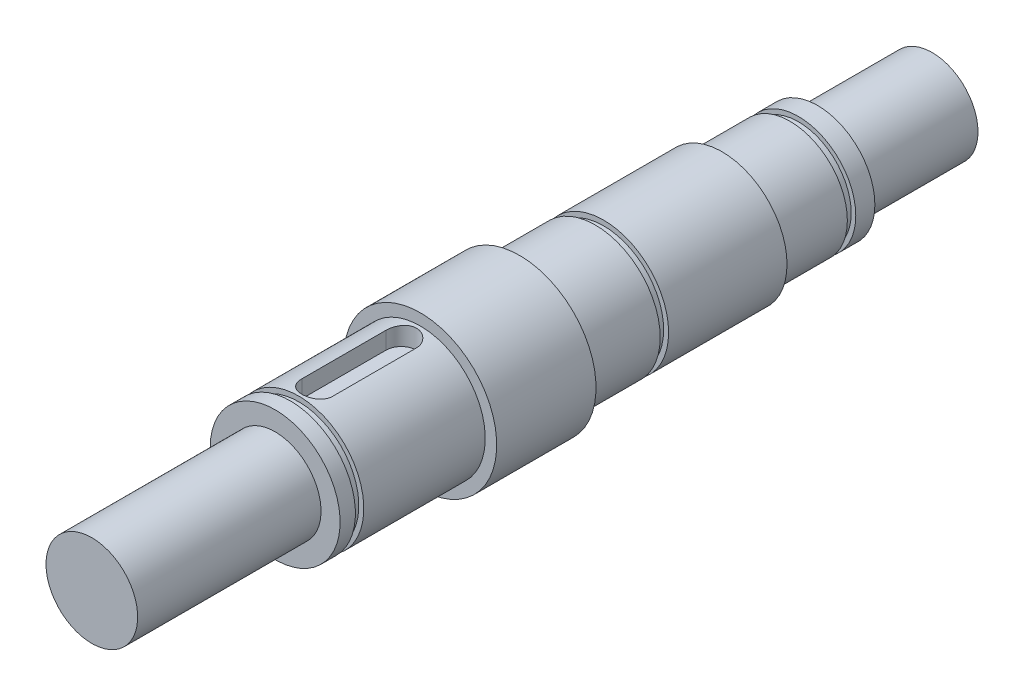
from build123d import *

# Parameters (mm, degrees)
SKETCH1_R               = 10
BOSS_EXTRUDE1_DEPTH     = 61
SKETCH3_W               = 66
SKETCH3_H               = 1.5
SKETCH4_W               = 43
SKETCH4_H               = 1.5
SKETCH5_W               = 24
SKETCH5_H               = 2.5
SKETCH6_W               = 39.5
SKETCH6_H               = 1
SKETCH7_W               = 27
SKETCH7_H               = 1.5
SKETCH8_W               = 1.1
SKETCH8_H               = 0.6
SKETCH9_W               = 1.1
SKETCH9_H               = 0.65
SKETCH10_W              = 1.1
SKETCH10_H              = 0.65
CUT_EXTRUDE1_DEPTH      = 63.617888818
CUT_EXTRUDE1_DEPTH_BACK = 63.617888818
SKETCH11_W              = 12
SKETCH11_H              = 12
CUT_EXTRUDE2_DEPTH      = 2.5


with BuildPart() as part:
    # Sketch1 → Boss-Extrude1 (new, symmetric)
    with BuildSketch(Plane.XY):
        with Locations(Location((0, 0, 0), (0, 0, 180))):
            Circle(SKETCH1_R)
    extrude(amount=BOSS_EXTRUDE1_DEPTH, both=True)

    # Sketch3 → Cut-Revolve1 (revolve, cut)
    with BuildSketch(Plane(origin=(0, 0, 0), x_dir=(0, 0, -1), z_dir=(1, 0, 0)), mode=Mode.PRIVATE) as cut_revolve1_sk:
        with Locations((28, 9.25)):
            Rectangle(SKETCH3_W, SKETCH3_H)
    revolve(cut_revolve1_sk.sketch.rotate(Axis((0, 0, 0), (0, 0, -1)), 270), axis=Axis((0, 0, 0), (0, 0, -1)), mode=Mode.SUBTRACT)

    # Sketch4 → Cut-Revolve2 (revolve, cut)
    with BuildSketch(Plane(origin=(0, 0, 0), x_dir=(0, 0, -1), z_dir=(1, 0, 0)), mode=Mode.PRIVATE) as cut_revolve2_sk:
        with Locations((-39.5, 9.25)):
            Rectangle(SKETCH4_W, SKETCH4_H)
    revolve(cut_revolve2_sk.sketch.rotate(Axis((0, 0, 0), (0, 0, 1)), 90), axis=Axis((0, 0, 0), (0, 0, 1)), mode=Mode.SUBTRACT)

    # Sketch5 → Cut-Revolve3 (revolve, cut)
    with BuildSketch(Plane(origin=(0, 0, 0), x_dir=(0, 0, -1), z_dir=(1, 0, 0)), mode=Mode.PRIVATE) as cut_revolve3_sk:
        with Locations((-49, 7.25)):
            Rectangle(SKETCH5_W, SKETCH5_H)
    revolve(cut_revolve3_sk.sketch.rotate(Axis((0, 0, 0), (0, 0, 1)), 90), axis=Axis((0, 0, 0), (0, 0, 1)), mode=Mode.SUBTRACT)

    # Sketch6 → Cut-Revolve4 (revolve, cut)
    with BuildSketch(Plane(origin=(0, 0, 0), x_dir=(0, 0, -1), z_dir=(1, 0, 0)), mode=Mode.PRIVATE) as cut_revolve4_sk:
        with Locations((41.25, 8)):
            Rectangle(SKETCH6_W, SKETCH6_H)
    revolve(cut_revolve4_sk.sketch.rotate(Axis((0, 0, 0), (0, 0, -1)), 90), axis=Axis((0, 0, 0), (0, 0, -1)), mode=Mode.SUBTRACT)

    # Sketch7 → Cut-Revolve5 (revolve, cut)
    with BuildSketch(Plane(origin=(0, 0, 0), x_dir=(0, 0, -1), z_dir=(1, 0, 0)), mode=Mode.PRIVATE) as cut_revolve5_sk:
        with Locations((47.5, 6.75)):
            Rectangle(SKETCH7_W, SKETCH7_H)
    revolve(cut_revolve5_sk.sketch.rotate(Axis((0, 0, 0), (0, 0, -1)), 90), axis=Axis((0, 0, 0), (0, 0, -1)), mode=Mode.SUBTRACT)

    # Sketch8 → Cut-Revolve6 (revolve, cut)
    with BuildSketch(Plane(origin=(0, 0, 0), x_dir=(0, 0, -1), z_dir=(1, 0, 0)), mode=Mode.PRIVATE) as cut_revolve6_sk:
        with Locations((30.95, 7.2)):
            Rectangle(SKETCH8_W, SKETCH8_H)
    revolve(cut_revolve6_sk.sketch.rotate(Axis((0, 0, 0), (0, 0, -1)), 90), axis=Axis((0, 0, 0), (0, 0, -1)), mode=Mode.SUBTRACT)

    # Sketch9 → Cut-Revolve7 (revolve, cut)
    with BuildSketch(Plane(origin=(0, 0, 0), x_dir=(0, 0, -1), z_dir=(1, 0, 0)), mode=Mode.PRIVATE) as cut_revolve7_sk:
        with Locations((5.45, 8.175)):
            Rectangle(SKETCH9_W, SKETCH9_H)
    revolve(cut_revolve7_sk.sketch.rotate(Axis((0, 0, 0), (0, 0, -1)), 90), axis=Axis((0, 0, 0), (0, 0, -1)), mode=Mode.SUBTRACT)

    # Sketch10 → Cut-Revolve8 (revolve, cut)
    with BuildSketch(Plane(origin=(0, 0, 0), x_dir=(0, 0, -1), z_dir=(1, 0, 0)), mode=Mode.PRIVATE) as cut_revolve8_sk:
        with Locations((-34.45, 8.175)):
            Rectangle(SKETCH10_W, SKETCH10_H)
    revolve(cut_revolve8_sk.sketch.rotate(Axis((0, 0, 0), (0, 0, 1)), 90), axis=Axis((0, 0, 0), (0, 0, 1)), mode=Mode.SUBTRACT)

    # Sketch11 → Cut-Extrude1 (cut, two sides: drawn at the far end of the back side and taken through both)
    with BuildSketch(Plane(origin=(0, 0, 0), x_dir=(0, 0, -1), z_dir=(1, 0, 0)).offset(-CUT_EXTRUDE1_DEPTH_BACK)):
        with Locations((55, 0)):
            Rectangle(SKETCH11_W, SKETCH11_H)
    extrude(amount=CUT_EXTRUDE1_DEPTH + CUT_EXTRUDE1_DEPTH_BACK, mode=Mode.SUBTRACT)

    # Sketch12 → Cut-Extrude2 (cut)
    with BuildSketch(Plane(origin=(0, 8.5, 0), x_dir=(1, 0, 0), z_dir=(0, 1, 0))):
        with BuildLine():
            Line((2, -31.5), (2, -20.5))
            ThreePointArc((2, -20.5), (0, -18.5), (-2, -20.5))
            Line((-2, -20.5), (-2, -31.5))
            ThreePointArc((-2, -31.5), (0, -33.5), (2, -31.5))
        make_face()
    extrude(amount=-CUT_EXTRUDE2_DEPTH, mode=Mode.SUBTRACT)


solid = part.part
